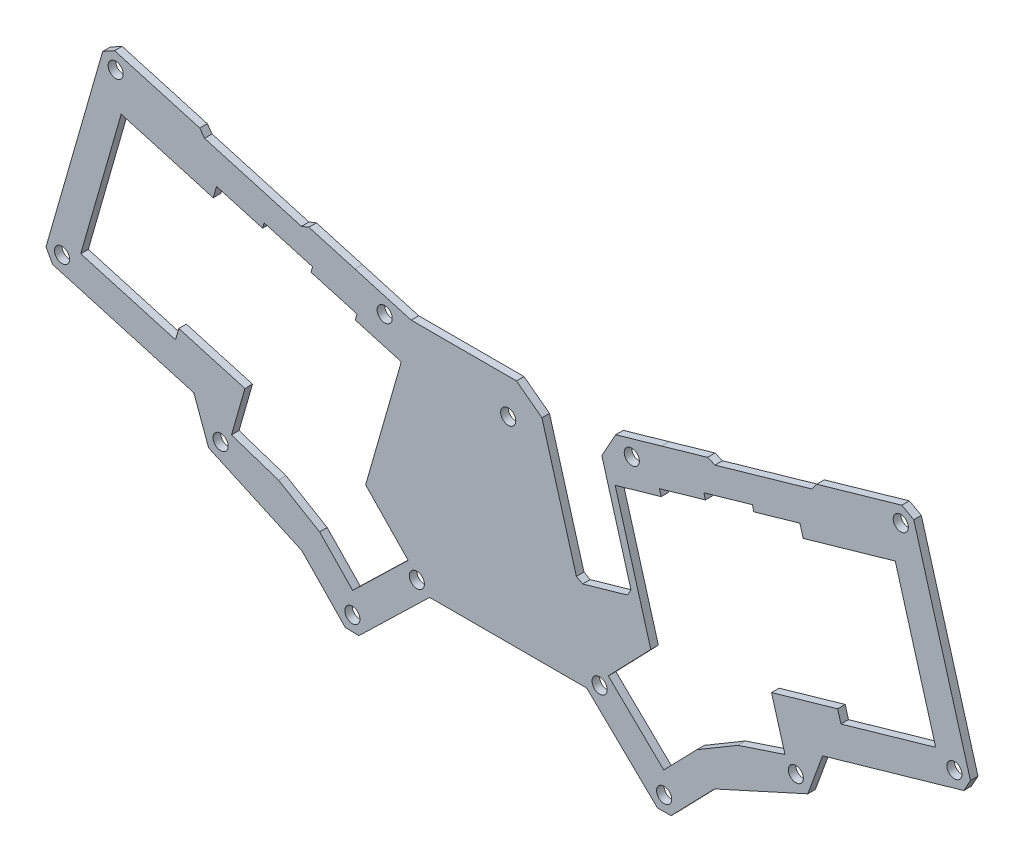
from build123d import *

# Parameters (mm, degrees)
ESQUISSE1_R        = 3
BOSS_EXTRU_1_DEPTH = 3


with BuildPart() as part:
    # Esquisse1 → Boss.-Extru.1 (new body)
    with BuildSketch(Plane.XY):
        Polygon((-130.649820486, -22.415487094), (-119.070790786, -62.796362516), (-120.442039466, -65.27016062), (-138.268849115, -70.381916029), (-140.742647218, -69.010667349), (-154.419403971, -21.314148304), (-164.521687886, -13.701531345), (-206.306232172, -13.701531345), (-228.687205956, -7.283890383), (-246.894010665, -2.064269008), (-249.872259625, -3.248768002), (-288.323340616, 7.774587685), (-290.221637422, 10.357120157), (-324.023652204, 20.047657387), (-328.759186056, 17.422535954), (-351.248940808, -61.008559605), (-348.624077987, -65.743937486), (-292.570685007, -81.816989279), (-286.703799003, -97.823971184), (-249.693611115, -114.655437515), (-232.462472657, -132.451258614), (-227.051679806, -132.536382762), (-198.975350278, -105.350948678), (-136.615169465, -105.350948678), (-108.538839937, -132.536382762), (-103.128047086, -132.451258614), (-85.896908628, -114.655437515), (-48.88672074, -97.823971184), (-43.019834736, -81.816989279), (13.033558244, -65.743937486), (15.658421065, -61.008559605), (-6.831333687, 17.422535954), (-11.566867539, 20.047657387), (-45.368882322, 10.357120157), (-47.267179127, 7.774587685), (-85.718260118, -3.248768002), (-88.696509078, -2.064269008), (-106.903313787, -7.283890383), (-125.164825765, -12.52029468), align=None)
        with Locations((9.292284284, -60.574933915)):
            Circle(ESQUISSE1_R, mode=Mode.SUBTRACT)
        with Locations((-323.590068827, 13.68165837)):
            Circle(ESQUISSE1_R, mode=Mode.SUBTRACT)
        with Locations((-216.832585966, -16.924131519)):
            Circle(ESQUISSE1_R, mode=Mode.SUBTRACT)
        with Locations((-167.795259872, -27.605548894)):
            Circle(ESQUISSE1_R, mode=Mode.SUBTRACT)
        with Locations((-118.757933777, -16.924131519)):
            Circle(ESQUISSE1_R, mode=Mode.SUBTRACT)
        with Locations((-12.000450916, 13.68165837)):
            Circle(ESQUISSE1_R, mode=Mode.SUBTRACT)
        with Locations((-229.666591606, -126.713325795)):
            Circle(ESQUISSE1_R, mode=Mode.SUBTRACT)
        with Locations((-204.059552706, -101.880200807)):
            Circle(ESQUISSE1_R, mode=Mode.SUBTRACT)
        with Locations((-281.934339477, -93.401689518)):
            Circle(ESQUISSE1_R, mode=Mode.SUBTRACT)
        with Locations((-344.882804027, -60.574933915)):
            Circle(ESQUISSE1_R, mode=Mode.SUBTRACT)
        Polygon((-210.232188047, -30.001147656), (-224.390430785, -79.377961929), (-208.212806214, -96.161100182), (-207.491865187, -96.85509979), (-208.236606037, -97.572971364), (-229.533063287, -118.225792128), (-242.655085998, -104.673746846), (-258.969310369, -95.012679745), (-277.629290011, -88.825419148), (-272.289144354, -70.202118055), (-298.538981418, -62.6750984), (-299.849714513, -67.246167925), (-337.461409717, -56.461187875), (-321.404434006, -0.463858857), (-284.873898651, -10.938821309), (-283.564528345, -6.372504389), (-265.299260667, -11.609985616), (-264.679553884, -9.448811229), (-245.452786066, -14.960840928), (-246.072799476, -17.123084647), (-227.807531798, -22.360565873), (-228.496674065, -24.763890567), align=None, mode=Mode.SUBTRACT)
        with Locations((-105.923928137, -126.713325795)):
            Circle(ESQUISSE1_R, mode=Mode.SUBTRACT)
        with Locations((-131.530967037, -101.880200807)):
            Circle(ESQUISSE1_R, mode=Mode.SUBTRACT)
        with Locations((-53.656180266, -93.401689518)):
            Circle(ESQUISSE1_R, mode=Mode.SUBTRACT)
        Polygon((-106.057456456, -118.225792128), (-128.0696158, -96.878899722), (-111.200088958, -79.377961929), (-125.358331696, -30.001147656), (-107.093845678, -24.763890567), (-107.782987945, -22.360565873), (-89.517720268, -17.123084647), (-90.137733677, -14.960840928), (-70.910965859, -9.448811229), (-70.291259076, -11.609985616), (-52.025991399, -6.372504389), (-50.716621092, -10.938821309), (-14.186085737, -0.463858857), (1.870889973, -56.461187875), (-35.740805231, -67.246167925), (-37.051538325, -62.6750984), (-63.301375389, -70.202118055), (-57.961229733, -88.825419148), (-76.621209374, -95.012679745), (-92.935433745, -104.673746846), align=None, mode=Mode.SUBTRACT)
    extrude(amount=BOSS_EXTRU_1_DEPTH)


solid = part.part
